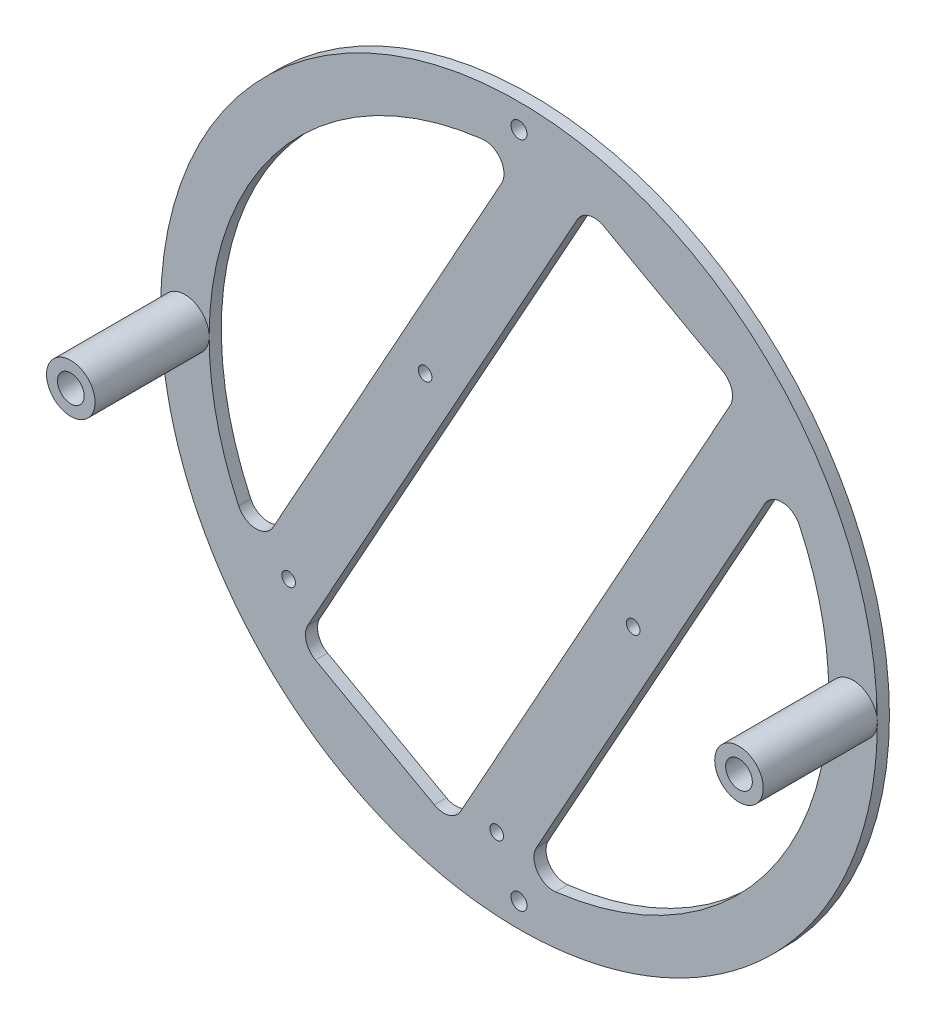
from build123d import *

# Parameters (mm, degrees)
SKETCH1_R           = 73.825
SKETCH1_R_2         = 1.65
SKETCH1_R_3         = 1.4
BOSS_EXTRUDE1_DEPTH = 2.5
FILLET1_R           = 4
SKETCH2_R           = 5
SKETCH2_R_2         = 2.75
BOSS_EXTRUDE2_DEPTH = 23.5


with BuildPart() as part:
    # Sketch1 → Boss-Extrude1 (new body)
    with BuildSketch(Plane.XY):
        Circle(SKETCH1_R)
        with Locations((0, 68.825)):
            Circle(SKETCH1_R_2, mode=Mode.SUBTRACT)
        with Locations((68.825, 0)):
            Circle(SKETCH1_R_2, mode=Mode.SUBTRACT)
        with Locations((0, -68.825)):
            Circle(SKETCH1_R_2, mode=Mode.SUBTRACT)
        with Locations((-68.825, 0)):
            Circle(SKETCH1_R_2, mode=Mode.SUBTRACT)
        with Locations((-4.595036818, -58.824966678)):
            Circle(SKETCH1_R_3, mode=Mode.SUBTRACT)
        with Locations((-47.451402468, -35.069295286)):
            Circle(SKETCH1_R_3, mode=Mode.SUBTRACT)
        with Locations((-19.332444494, 15.658647728)):
            Circle(SKETCH1_R_3, mode=Mode.SUBTRACT)
        with Locations((23.523921156, -8.097023664)):
            Circle(SKETCH1_R_3, mode=Mode.SUBTRACT)
        with BuildLine():
            Line((-0.065219366, 63.824966678), (-54.161202477, -33.766770223))
            ThreePointArc((-54.161202477, -33.766770223), (-55.822602808, 30.942974012), (-0.065219366, 63.824966678))
        make_face(mode=Mode.SUBTRACT)
        with BuildLine():
            Line((0.065219366, -63.824966678), (54.161202477, 33.766770223))
            ThreePointArc((54.161202477, 33.766770223), (55.822602808, -30.942974012), (0.065219366, -63.824966678))
        make_face(mode=Mode.SUBTRACT)
        Polygon((-45.430097338, -44.830089012), (13.943787881, 62.283235341), (45.430097338, 44.830089012), (-13.943787881, -62.283235341), align=None, mode=Mode.SUBTRACT)
    extrude(amount=BOSS_EXTRUDE1_DEPTH)

    # Fillet1
    fillet1_edges = [part.edges().sort_by_distance(p)[0] for p in [
        (-0.065219366, 63.824966678, 1.25),
        (-54.161202477, -33.766770223, 1.25),
        (-45.430097338, -44.830089012, 1.25),
        (-13.943787881, -62.283235341, 1.25),
        (45.430097338, 44.830089012, 1.25),
        (13.943787881, 62.283235341, 1.25),
        (54.161202477, 33.766770223, 1.25),
        (0.065219366, -63.824966678, 1.25),
    ]]
    fillet(fillet1_edges, radius=FILLET1_R)

    # Sketch2 → Boss-Extrude2 (add)
    # profile 1 of 2: a face of its own
    with BuildSketch(Plane.XY.offset(2.5)):
        with Locations(Location((-68.825, 0, 0), (0, 0, 179.99962476))):
            Circle(SKETCH2_R)
        with Locations((-68.825, 0)):
            Circle(SKETCH2_R_2, mode=Mode.SUBTRACT)
    # profile 2 of 2: a face of its own
    with BuildSketch(Plane.XY.offset(2.5)):
        with Locations(Location((68.825, 0, 0), (0, 0, 179.999650978))):
            Circle(SKETCH2_R)
        with Locations((68.825, 0)):
            Circle(SKETCH2_R_2, mode=Mode.SUBTRACT)
    extrude(amount=BOSS_EXTRUDE2_DEPTH)


solid = part.part
